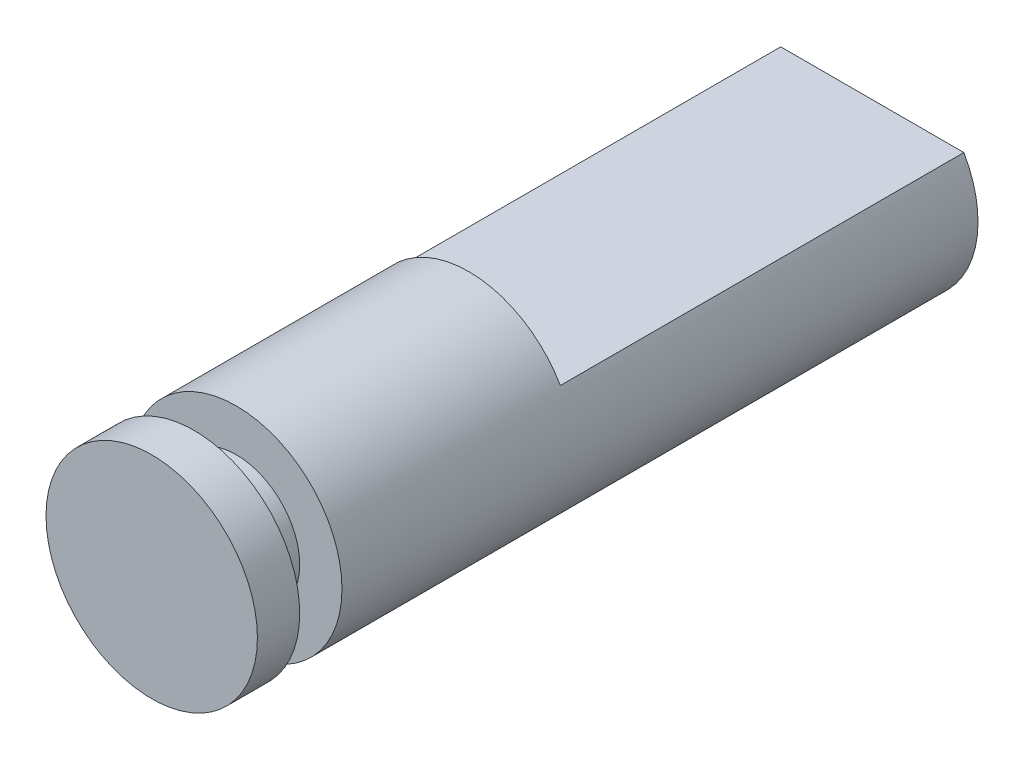
from build123d import *

# Parameters (mm, degrees)
BOSS_EXTRUDE1_DEPTH = 19.0848469
SKETCH2_R           = 5
BOSS_EXTRUDE2_DEPTH = 15
CUT_EXTRUDE1_START  = -2
SKETCH3_R           = 5
SKETCH3_R_2         = 3
CUT_EXTRUDE1_DEPTH  = 2


with BuildPart() as part:
    # Sketch1 → Boss-Extrude1 (new body)
    with BuildSketch(Plane.XY):
        with BuildLine():
            Line((0, 2.5), (-4.330127019, 2.5))
            ThreePointArc((-4.330127019, 2.5), (0, -5), (4.330127019, 2.5))
            Line((4.330127019, 2.5), (0, 2.5))
        make_face()
    extrude(amount=BOSS_EXTRUDE1_DEPTH)

    # Sketch2 → Boss-Extrude2 (add)
    with BuildSketch(Plane.XY.offset(19.0848469)):
        with Locations(Location((0, 0, 0), (0, 0, 150))):
            Circle(SKETCH2_R)
    extrude(amount=BOSS_EXTRUDE2_DEPTH)

    # Sketch3 → Cut-Extrude1 (cut)
    with BuildSketch(Plane.XY.offset(32.0848469).offset(CUT_EXTRUDE1_START)):
        with Locations(Location((0, 0, 0), (0, 0, 150))):
            Circle(SKETCH3_R)
        Circle(SKETCH3_R_2, mode=Mode.SUBTRACT)
    extrude(amount=CUT_EXTRUDE1_DEPTH, mode=Mode.SUBTRACT)


solid = part.part
